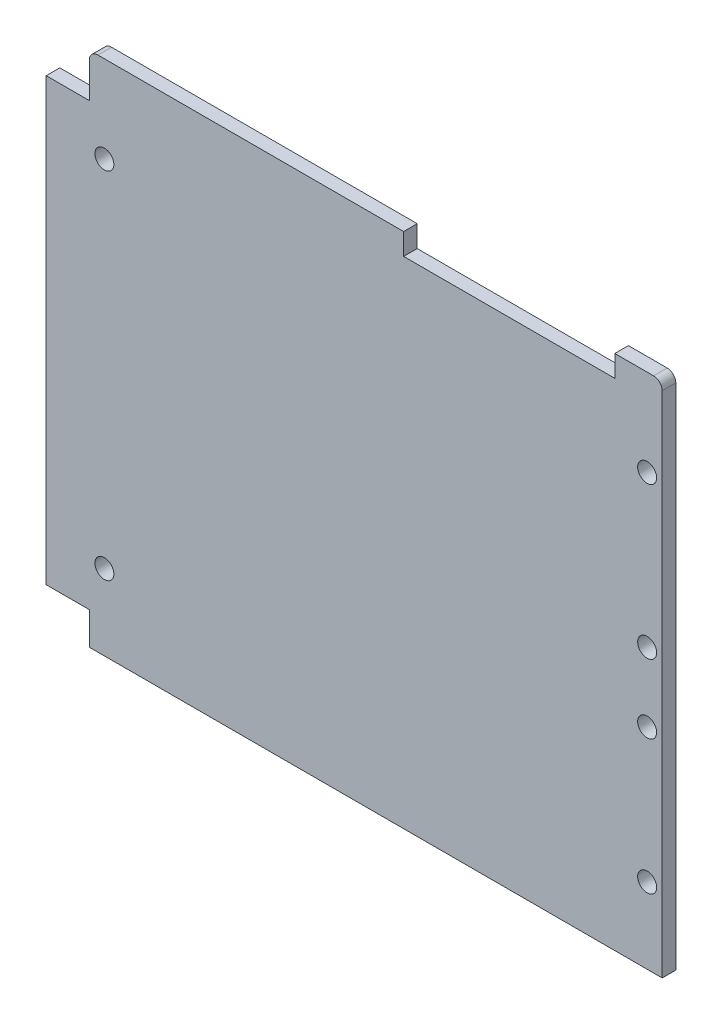
from build123d import *

# Parameters (mm, degrees)
BOSS_EXTRUDE1_DEPTH  = 1.5748
SKETCH3_W            = 66.47
SKETCH3_H            = 5.335951997
BOSS_EXTRUDE2_DEPTH  = 1.575
SKETCH4_W            = 66.47
SKETCH4_H            = 0.5
CUT_EXTRUDE1_DEPTH   = 134.633133513
M2_CLEARANCE_HOLE1_D = 2.2
SKETCH5_W            = 5
SKETCH5_H            = 51.15
BOSS_EXTRUDE3_DEPTH  = 1.575
SKETCH6_W            = 24.5
SKETCH6_H            = 2.5
CUT_EXTRUDE2_DEPTH   = 134.633133513


with BuildPart() as part:
    # BPR2 PCB Outline → Boss-Extrude1 (new body)
    with BuildSketch(Plane.XY):
        with BuildLine():
            Line((114.542984325, 6.620432961), (102.642984325, 6.620432961))
            Line((102.642984325, 6.620432961), (82.642984325, 6.620432961))
            Line((82.642984325, 6.620432961), (49.072984325, 6.620432961))
            Line((49.072984325, 6.620432961), (49.072984325, 66.120432961))
            ThreePointArc((49.072984325, 66.120432961), (49.365877543, 66.827539743), (50.072984325, 67.120432961))
            Line((50.072984325, 67.120432961), (114.542984325, 67.120432961))
            ThreePointArc((114.542984325, 67.120432961), (115.250091106, 66.827539743), (115.542984325, 66.120432961))
            Line((115.542984325, 66.120432961), (115.542984325, 7.620432961))
            ThreePointArc((115.542984325, 7.620432961), (115.250091106, 6.91332618), (114.542984325, 6.620432961))
        make_face()
    extrude(amount=-BOSS_EXTRUDE1_DEPTH)

    # Sketch3 → Boss-Extrude2 (add)
    with BuildSketch(Plane.XY):
        with Locations((82.307984325, 9.288408959)):
            Rectangle(SKETCH3_W, SKETCH3_H)
    extrude(amount=-BOSS_EXTRUDE2_DEPTH)

    # Sketch4 → Cut-Extrude1 (cut, through all)
    with BuildSketch(Plane.XY):
        with Locations((82.307984325, 6.870432961)):
            Rectangle(SKETCH4_W, SKETCH4_H)
    extrude(amount=-CUT_EXTRUDE1_DEPTH, mode=Mode.SUBTRACT)

    # M2 Clearance Hole1 (through all)
    with Locations(Plane(origin=(32.762906477, 104.007481373, -6.5748), x_dir=(1, 0, 0), z_dir=(0, 0, -1))):
        with Locations((18.060077848, 88.112048412), (18.060077848, 46.962048412), (81.030077848, 46.962048412), (81.030077848, 64.537048412), (81.030077848, 88.112048412), (81.030077848, 72.537048412)):
            Hole(M2_CLEARANCE_HOLE1_D / 2)

    # Sketch5 → Boss-Extrude3 (add)
    with BuildSketch(Plane.XY):
        with Locations((46.572984325, 36.470432961)):
            Rectangle(SKETCH5_W, SKETCH5_H)
    extrude(amount=-BOSS_EXTRUDE3_DEPTH)

    # Sketch6 → Cut-Extrude2 (cut, through all)
    with BuildSketch(Plane.XY):
        with Locations((97.792984325, 65.870432961)):
            Rectangle(SKETCH6_W, SKETCH6_H)
    extrude(amount=-CUT_EXTRUDE2_DEPTH, mode=Mode.SUBTRACT)


solid = part.part
